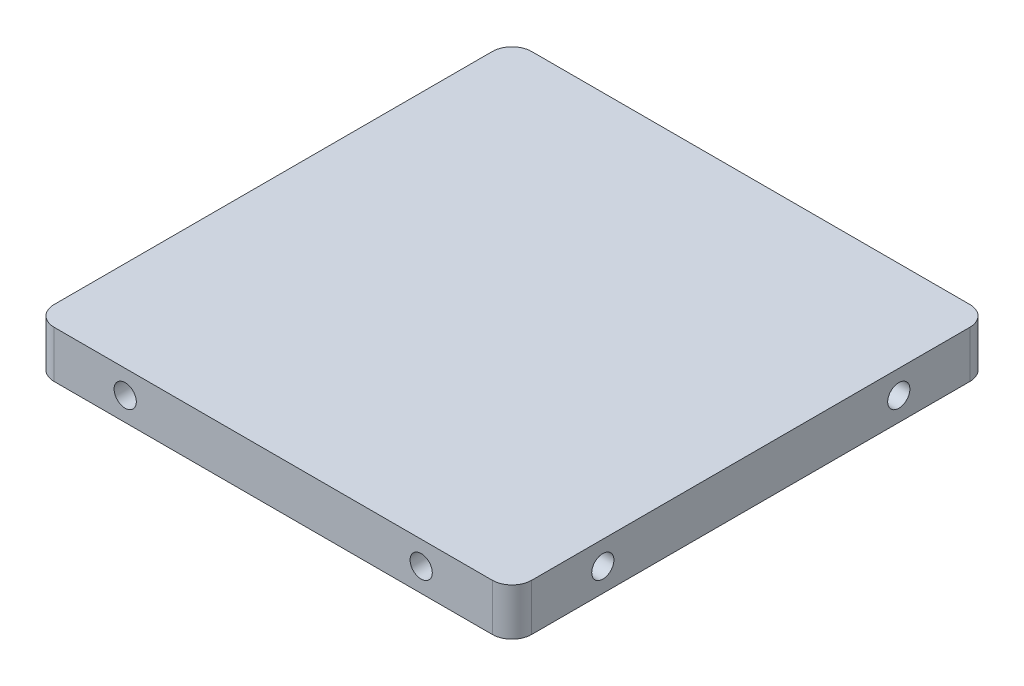
from build123d import *

# Parameters (mm, degrees)
SKETCH1_W            = 96.825
SKETCH1_H            = 96.825
BOSS_EXTRUDE1_DEPTH  = 4.7625
FILLET1_R            = 4
M4_CLEARANCE_HOLE1_D = 4.5
M4_CLEARANCE_HOLE2_D = 4.5


with BuildPart() as part:
    # Sketch1 → Boss-Extrude1 (new, symmetric)
    with BuildSketch(Plane(origin=(0, 0, 0), x_dir=(1, 0, 0), z_dir=(0, 1, 0))):
        Rectangle(SKETCH1_W, SKETCH1_H)
    extrude(amount=BOSS_EXTRUDE1_DEPTH, both=True)

    # Fillet1
    fillet1_edges = [part.edges().sort_by_distance(p)[0] for p in [
        (-48.4125, 0, -48.4125),
        (48.4125, 0, -48.4125),
        (48.4125, 0, 48.4125),
        (-48.4125, 0, 48.4125),
    ]]
    fillet(fillet1_edges, radius=FILLET1_R)

    # M4 Clearance Hole1 (through all)
    with Locations(Plane.ZY.offset(48.4125)):
        with Locations((-30, 0), (30, 0)):
            Hole(M4_CLEARANCE_HOLE1_D / 2)

    # M4 Clearance Hole2 (through all)
    with Locations(Plane(origin=(0, 0, -48.4125), x_dir=(-1, 0, 0), z_dir=(0, 0, -1))):
        with Locations((-30, 0), (30, 0)):
            Hole(M4_CLEARANCE_HOLE2_D / 2)


solid = part.part
